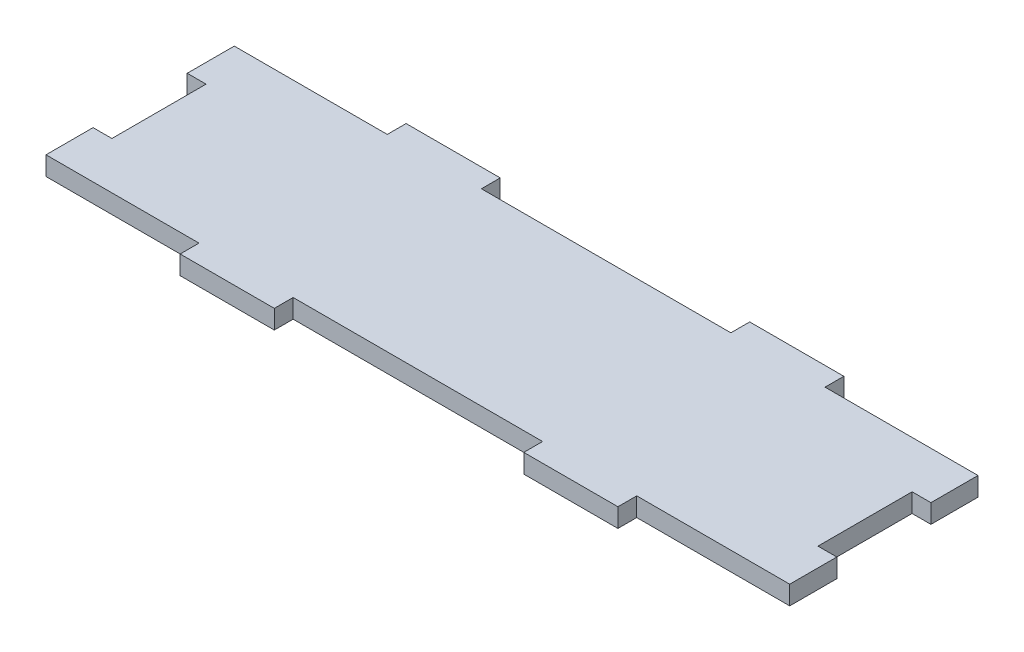
from build123d import *

# Parameters (mm, degrees)
SALIENTE_EXTRUIR1_DEPTH = 4


with BuildPart() as part:
    # Croquis1 → Saliente-Extruir1 (new body)
    with BuildSketch(Plane(origin=(0, 0, 0), x_dir=(1, 0, 0), z_dir=(0, 1, 0))):
        Polygon((0, 0), (28.5, 0), (28.5, -4), (48.5, -4), (48.5, 0), (101.5, 0), (101.5, -4), (121.5, -4), (121.5, 0), (150, 0), (154, 0), (154, 10), (150, 10), (150, 30), (154, 30), (154, 40), (150, 40), (121.5, 40), (121.5, 44), (101.5, 44), (101.5, 40), (48.5, 40), (48.5, 44), (28.5, 44), (28.5, 40), (0, 40), (-4, 40), (-4, 30), (0, 30), (0, 10), (-4, 10), (-4, 0), align=None)
    extrude(amount=SALIENTE_EXTRUIR1_DEPTH)


solid = part.part
